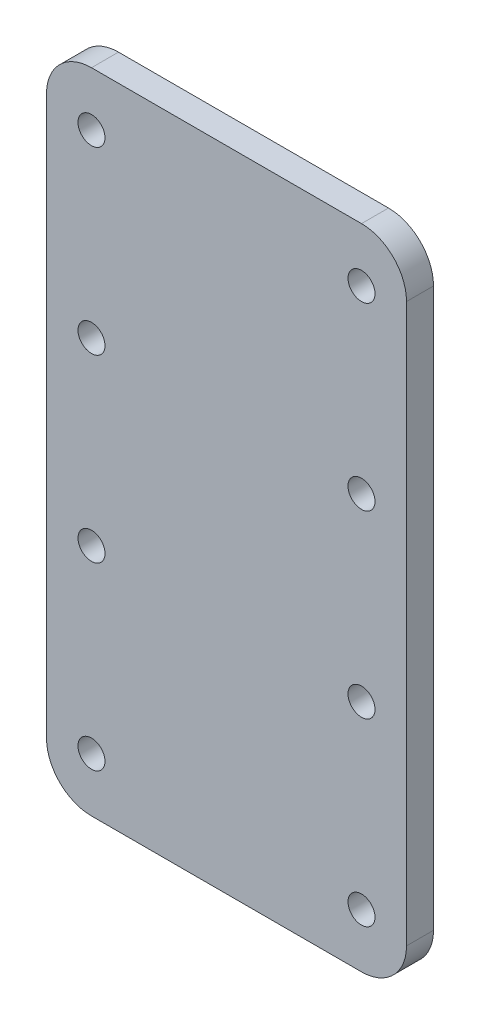
from build123d import *

# Parameters (mm, degrees)
SKETCH_1_W          = 40
SKETCH_1_H          = 72
EXTRUDE_1_DEPTH     = 3
SKETCH_2_R          = 1.5
CUT_EXTRUDE_1_DEPTH = 3
FILLET_1_R          = 5


with BuildPart() as part:
    # 草图1 → 凸台-拉伸1 (new body)
    with BuildSketch(Plane.XY):
        Rectangle(SKETCH_1_W, SKETCH_1_H)
    extrude(amount=EXTRUDE_1_DEPTH)

    # 草图2 → 切除-拉伸1 (cut)
    with BuildSketch(Plane.XY.offset(3)):
        with Locations((-15, 30)):
            Circle(SKETCH_2_R)
        with Locations((-15, 10)):
            Circle(SKETCH_2_R)
        with Locations((15, 30)):
            Circle(SKETCH_2_R)
        with Locations((15, 10)):
            Circle(SKETCH_2_R)
        with Locations(Location((-15, -10, 0), (0, 0, 180))):
            Circle(SKETCH_2_R)
        with Locations(Location((15, -10, 0), (0, 0, 180))):
            Circle(SKETCH_2_R)
        with Locations(Location((15, -30, 0), (0, 0, 180))):
            Circle(SKETCH_2_R)
        with Locations(Location((-15, -30, 0), (0, 0, 180))):
            Circle(SKETCH_2_R)
    extrude(amount=-CUT_EXTRUDE_1_DEPTH, mode=Mode.SUBTRACT)

    # 圆角1
    fillet_1_edges = [part.edges().sort_by_distance(p)[0] for p in [
        (20, -36, 1.5),
        (-20, -36, 1.5),
        (-20, 36, 1.5),
        (20, 36, 1.5),
    ]]
    fillet(fillet_1_edges, radius=FILLET_1_R)


solid = part.part
